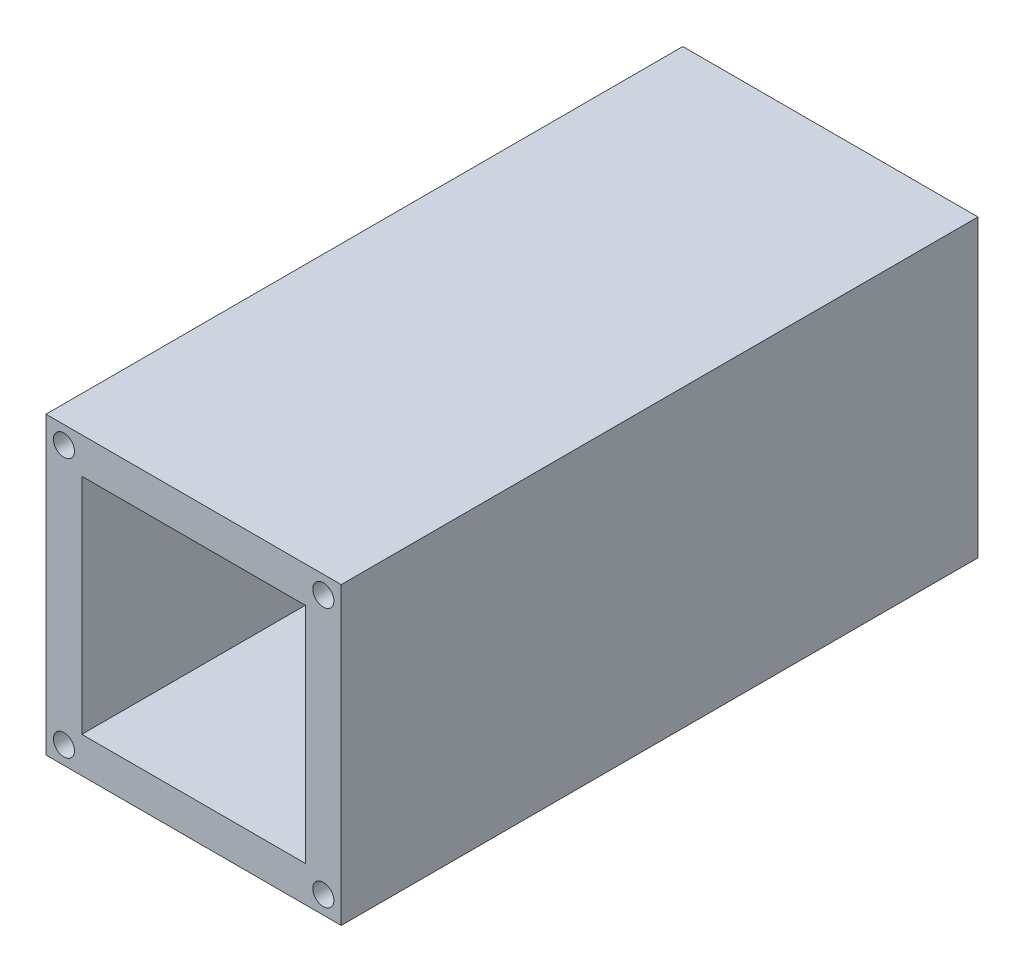
from build123d import *

# Parameters (mm, degrees)
CROQUIS1_W              = 35
CROQUIS1_H              = 35
SALIENTE_EXTRUIR2_DEPTH = 75.5
CROQUIS2_W              = 26.5
CROQUIS2_H              = 26.5
CORTAR_EXTRUIR1_DEPTH   = 80
CROQUIS4_R              = 1.25
CORTAR_EXTRUIR2_DEPTH   = 10
CROQUIS6_W              = 26.5
CROQUIS6_H              = 26.5
SALIENTE_EXTRUIR3_DEPTH = 30
CORTAR_EXTRUIR3_DEPTH   = 27
CROQUIS8_W              = 26.5
CROQUIS8_H              = 26.5
CORTAR_EXTRUIR4_DEPTH   = 23
CORTAR_EXTRUIR5_START   = -10
CROQUIS9_R              = 1.25
CORTAR_EXTRUIR5_DEPTH   = 10


with BuildPart() as part:
    # Croquis1 → Saliente-Extruir2 (new body)
    with BuildSketch(Plane.XY):
        Rectangle(CROQUIS1_W, CROQUIS1_H)
    extrude(amount=SALIENTE_EXTRUIR2_DEPTH)

    # Croquis2 → Cortar-Extruir1 (cut)
    with BuildSketch(Plane.XY.offset(75.5)):
        Rectangle(CROQUIS2_W, CROQUIS2_H)
    extrude(amount=-CORTAR_EXTRUIR1_DEPTH, mode=Mode.SUBTRACT)

    # Croquis4 → Cortar-Extruir2 (cut)
    with BuildSketch(Plane.XY.offset(75.5)):
        with Locations((-15.375, 15.38)):
            Circle(CROQUIS4_R)
        with Locations((15.38, 15.38)):
            Circle(CROQUIS4_R)
        with Locations((15.38, -15.38)):
            Circle(CROQUIS4_R)
        with Locations((-15.375, -15.38)):
            Circle(CROQUIS4_R)
    extrude(amount=-CORTAR_EXTRUIR2_DEPTH, mode=Mode.SUBTRACT)

    # Croquis6 → Saliente-Extruir3 (add)
    with BuildSketch(Plane.XY.offset(7)):
        Rectangle(CROQUIS6_W, CROQUIS6_H)
    extrude(amount=SALIENTE_EXTRUIR3_DEPTH)

    # Croquis7 → Cortar-Extruir3 (cut)
    with BuildSketch(Plane.XY.offset(37)):
        with BuildLine():
            Line((13.25, -5), (13.25, 5))
            Line((13.25, 5), (8.385525636, 9.270003226))
            ThreePointArc((8.385525636, 9.270003226), (0, 12.428301163), (-8.385525636, 9.270003226))
            Line((-8.385525636, 9.270003226), (-13.25, 5))
            Line((-13.25, 5), (-13.25, -5))
            Line((-13.25, -5), (-8.385525636, -9.270003226))
            ThreePointArc((-8.385525636, -9.270003226), (0, -12.428301163), (8.385525636, -9.270003226))
            Line((8.385525636, -9.270003226), (13.25, -5))
        make_face()
    extrude(amount=-CORTAR_EXTRUIR3_DEPTH, mode=Mode.SUBTRACT)

    # Croquis8 → Cortar-Extruir4 (cut)
    with BuildSketch(Plane(origin=(0, 0, 7), x_dir=(-1, 0, 0), z_dir=(0, 0, -1))):
        Rectangle(CROQUIS8_W, CROQUIS8_H)
    extrude(amount=-CORTAR_EXTRUIR4_DEPTH, mode=Mode.SUBTRACT)

    # Croquis9 → Cortar-Extruir5 (cut)
    with BuildSketch(Plane(origin=(0, 0, 0), x_dir=(-1, 0, 0), z_dir=(0, 0, -1)).offset(CORTAR_EXTRUIR5_START)):
        with Locations(Location((-15.38, 15.38, 0), (0, 0, 180))):
            Circle(CROQUIS9_R)
        with Locations((15.38, 15.38)):
            Circle(CROQUIS9_R)
        with Locations((15.38, -15.38)):
            Circle(CROQUIS9_R)
        with Locations(Location((-15.38, -15.38, 0), (0, 0, 180))):
            Circle(CROQUIS9_R)
    extrude(amount=CORTAR_EXTRUIR5_DEPTH, mode=Mode.SUBTRACT)


solid = part.part
